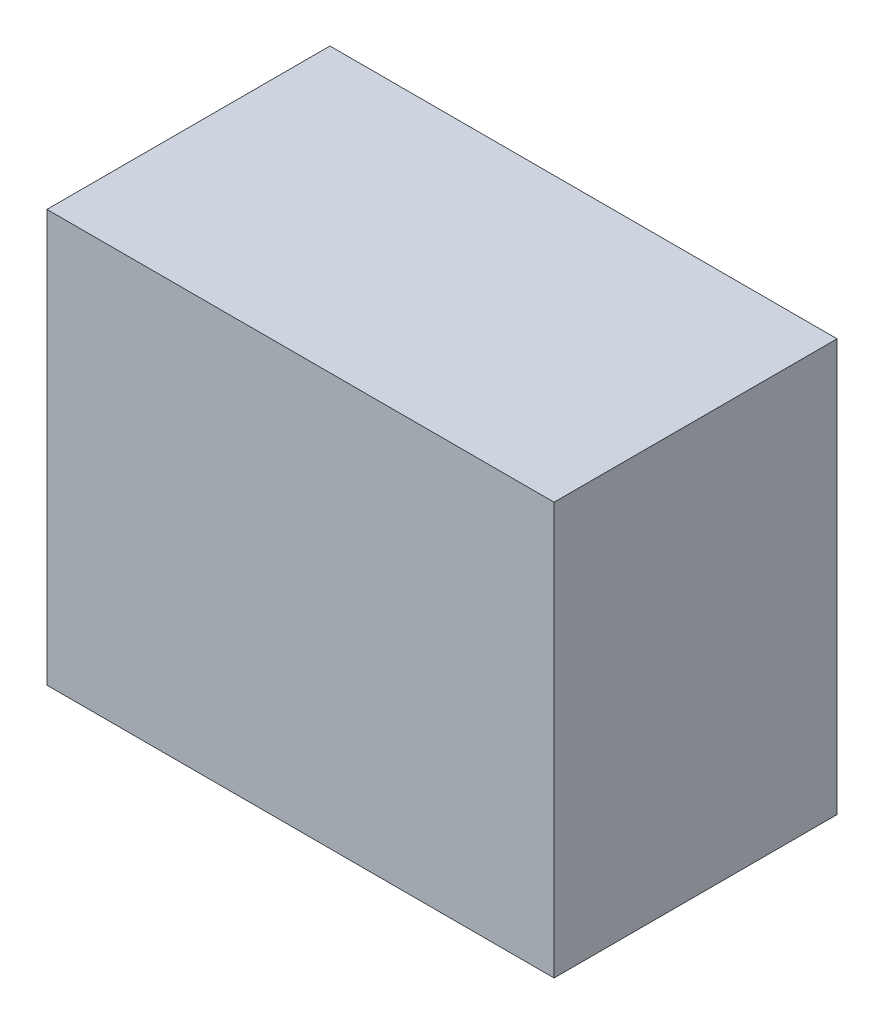
from build123d import *

# Parameters (mm, degrees)
SKETCH1_W           = 22.4
SKETCH1_H           = 12.5
BOSS_EXTRUDE1_DEPTH = 18.2


with BuildPart() as part:
    # Sketch1 → Boss-Extrude1 (new body)
    with BuildSketch(Plane(origin=(0, 0, 0), x_dir=(1, 0, 0), z_dir=(0, 1, 0))):
        Rectangle(SKETCH1_W, SKETCH1_H)
    extrude(amount=BOSS_EXTRUDE1_DEPTH)


solid = part.part
